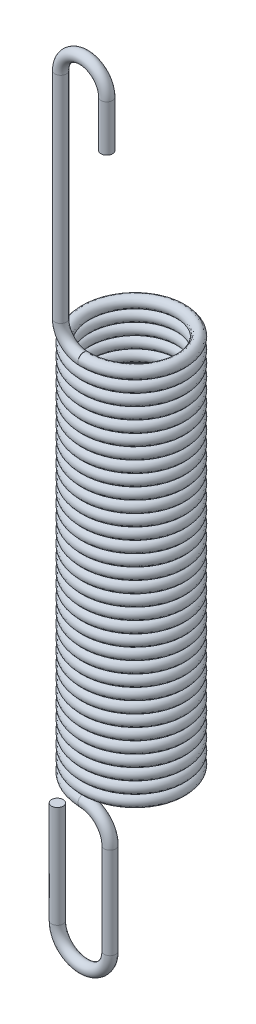
from build123d import *

# Parameters (mm, degrees)
SWEEP4_PROFILE_R = 2.375
SWEEP5_PROFILE_R = 2.375
SWEEP6_PITCH     = 4.766363636
SWEEP6_HEIGHT    = 157.29
SWEEP6_RADIUS    = 19.6
SWEEP6_PROFILE_R = 2.375


with BuildPart() as part:
    # Sweep4: sweep along a path in Sketch3
    with BuildLine(Plane.XY.offset(19.6)) as sweep4_path:
        Line((-10.85, -6.5), (-10.85, -48.5))
        ThreePointArc((-10.85, -48.5), (0, -59.35), (10.85, -48.5))
        Line((10.85, -48.5), (10.85, -10.85))
        ThreePointArc((10.85, -10.85), (7.672108576, -3.177891424), (0, 0))
    # Sweep4 profile (on start of the path) → Sweep4 (sweep)
    with BuildSketch(Plane(origin=(-10.85, -6.5, 19.6), x_dir=(-1, 0, 0), z_dir=(0, -1, 0))):
        Circle(SWEEP4_PROFILE_R)
    sweep(path=sweep4_path.line)


with BuildPart() as body_2:
    # Sweep5: sweep along a path in Sketch5
    with BuildLine(Plane.XY.offset(19.6)) as sweep5_path:
        Line((9.5, 236.29), (9.5, 255.29))
        ThreePointArc((9.5, 255.29), (0, 264.79), (-9.5, 255.29))
        Line((-9.5, 255.29), (-9.5, 166.79))
        ThreePointArc((-9.5, 166.79), (-6.717514421, 160.072485579), (0, 157.29))
    # Sweep5 profile (on start of the path) → Sweep5 (sweep)
    with BuildSketch(Plane(origin=(9.5, 236.29, 19.6), x_dir=(1, 0, 0), z_dir=(0, 1, 0))):
        Circle(SWEEP5_PROFILE_R)
    sweep(path=sweep5_path.line)


with BuildPart() as body_3:
    # Sweep6: sweep along a helix
    with BuildLine() as sweep6_path:
        Helix(SWEEP6_PITCH, SWEEP6_HEIGHT, SWEEP6_RADIUS, center=(0, 0, 0), direction=(0, 1, 0), lefthand=True)
    # Sweep6 profile (on start of the path) → Sweep6 (sweep)
    with BuildSketch(Plane(origin=(0, 0, 19.6), x_dir=(-0.038674632597060984, -0.9992518565374209, 0), z_dir=(-0.9992518565374209, 0.038674632597060984, 1.368600454275373e-13))):
        Circle(SWEEP6_PROFILE_R)
    sweep(path=sweep6_path.line, is_frenet=True)


solid = Compound([part.part, body_2.part, body_3.part])
